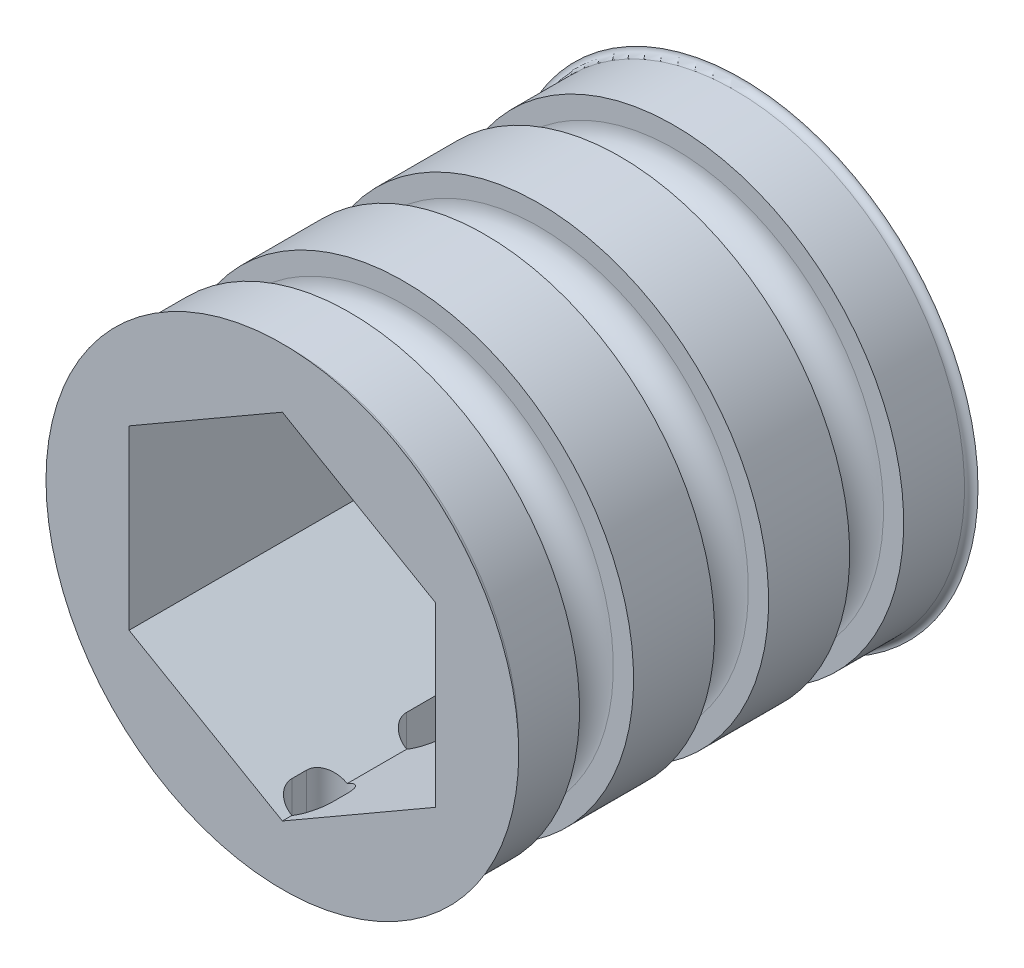
from build123d import *

# Parameters (mm, degrees)
ESQUISSE1_R              = 18
ESQUISSE1_R_2            = 3.25
BOSS_EXTRU_1_DEPTH       = 34
ENL_V_MAT_EXTRU_9_DEPTH  = 18
ESQUISSE11_R             = 2.1
ENL_V_MAT_EXTRU_10_DEPTH = 43.473521163
ESQUISSE12_R             = 4.25
ENL_V_MAT_EXTRU_11_DEPTH = 4
ESQUISSE14_R             = 13.105851111
ENL_V_MAT_EXTRU_12_DEPTH = 12
ENL_V_MAT_EXTRU_13_DEPTH = 43.053537307


with BuildPart() as part:
    # Esquisse1 → Boss.-Extru.1 (new body)
    with BuildSketch(Plane.XY):
        Circle(ESQUISSE1_R)
        Circle(ESQUISSE1_R_2, mode=Mode.SUBTRACT)
    extrude(amount=BOSS_EXTRU_1_DEPTH)

    # Esquisse9 → Enlèv. mat.-Extru.9 (cut)
    with BuildSketch(Plane.XY.offset(34)):
        Polygon((11.35, -6.552925555), (11.35, 6.552925555), (0, 13.105851111), (-11.35, 6.552925555), (-11.35, -6.552925555), (0, -13.105851111), align=None)
    extrude(amount=-ENL_V_MAT_EXTRU_9_DEPTH, mode=Mode.SUBTRACT)

    # Esquisse11 → Enlèv. mat.-Extru.10 (cut, through all)
    with BuildSketch(Plane(origin=(0, 0, 0), x_dir=(-1, 0, 0), z_dir=(0, 0, -1))):
        with Locations((-6.92820323, 4)):
            Circle(ESQUISSE11_R)
        with Locations((6.92820323, 4)):
            Circle(ESQUISSE11_R)
        with Locations((0, -8)):
            Circle(ESQUISSE11_R)
    extrude(amount=-ENL_V_MAT_EXTRU_10_DEPTH, mode=Mode.SUBTRACT)

    # Esquisse12 → Enlèv. mat.-Extru.11 (cut)
    with BuildSketch(Plane(origin=(0, 0, 0), x_dir=(-1, 0, 0), z_dir=(0, 0, -1))):
        with Locations((-6.92820323, 4)):
            Circle(ESQUISSE12_R)
        with Locations((6.92820323, 4)):
            Circle(ESQUISSE12_R)
        with Locations((0, -8)):
            Circle(ESQUISSE12_R)
    extrude(amount=-ENL_V_MAT_EXTRU_11_DEPTH, mode=Mode.SUBTRACT)

    # Esquisse13 → Enlèvement de matière-Révolution1 (revolve, cut)
    with BuildSketch(Plane(origin=(0, 0, 0), x_dir=(1, 0, 0), z_dir=(0, 1, 0))):
        with BuildLine():
            Line((-18, -34), (-17.5, -34))
            ThreePointArc((-17.5, -34), (-17.146446609, -33.853553391), (-17, -33.5))
            Line((-17, -33.5), (-17, -29))
            Line((-17, -29), (-15.5, -29))
            ThreePointArc((-15.5, -29), (-13.5, -27), (-15.5, -25))
            Line((-15.5, -25), (-17, -25))
            Line((-17, -25), (-17, -19))
            Line((-17, -19), (-15.5, -19))
            ThreePointArc((-15.5, -19), (-13.5, -17), (-15.5, -15))
            Line((-15.5, -15), (-17, -15))
            Line((-17, -15), (-17, -9))
            Line((-17, -9), (-15.5, -9))
            ThreePointArc((-15.5, -9), (-13.5, -7), (-15.5, -5))
            Line((-15.5, -5), (-17, -5))
            Line((-17, -5), (-17, -0.5))
            ThreePointArc((-17, -0.5), (-17.146446609, -0.146446609), (-17.5, 0))
            Line((-17.5, 0), (-18, 0))
            Line((-18, 0), (-18, -34))
        make_face()
    revolve(axis=Axis((0, 0, 0), (0, 0, 1)), mode=Mode.SUBTRACT)

    # Esquisse14 → Enlèv. mat.-Extru.12 (cut)
    with BuildSketch(Plane(origin=(0, 0, 0), x_dir=(-1, 0, 0), z_dir=(0, 0, -1))):
        Circle(ESQUISSE14_R)
    extrude(amount=-ENL_V_MAT_EXTRU_12_DEPTH, mode=Mode.SUBTRACT)

    # Esquisse15 → Enlèv. mat.-Extru.13 (cut, through all)
    with BuildSketch(Plane(origin=(0, 0, 0), x_dir=(1, 0, 0), z_dir=(0, 1, 0))):
        with BuildLine():
            Line((1.5, -20.7), (1.5, -23.3))
            ThreePointArc((1.5, -23.3), (0, -24.8), (-1.5, -23.3))
            Line((-1.5, -23.3), (-1.5, -20.7))
            ThreePointArc((-1.5, -20.7), (0, -19.2), (1.5, -20.7))
        make_face()
        with BuildLine():
            Line((1.5, -30.7), (1.5, -31.8))
            ThreePointArc((1.5, -31.8), (0, -33.3), (-1.5, -31.8))
            Line((-1.5, -31.8), (-1.5, -30.7))
            ThreePointArc((-1.5, -30.7), (0, -29.2), (1.5, -30.7))
        make_face()
    extrude(amount=-ENL_V_MAT_EXTRU_13_DEPTH, mode=Mode.SUBTRACT)


solid = part.part
